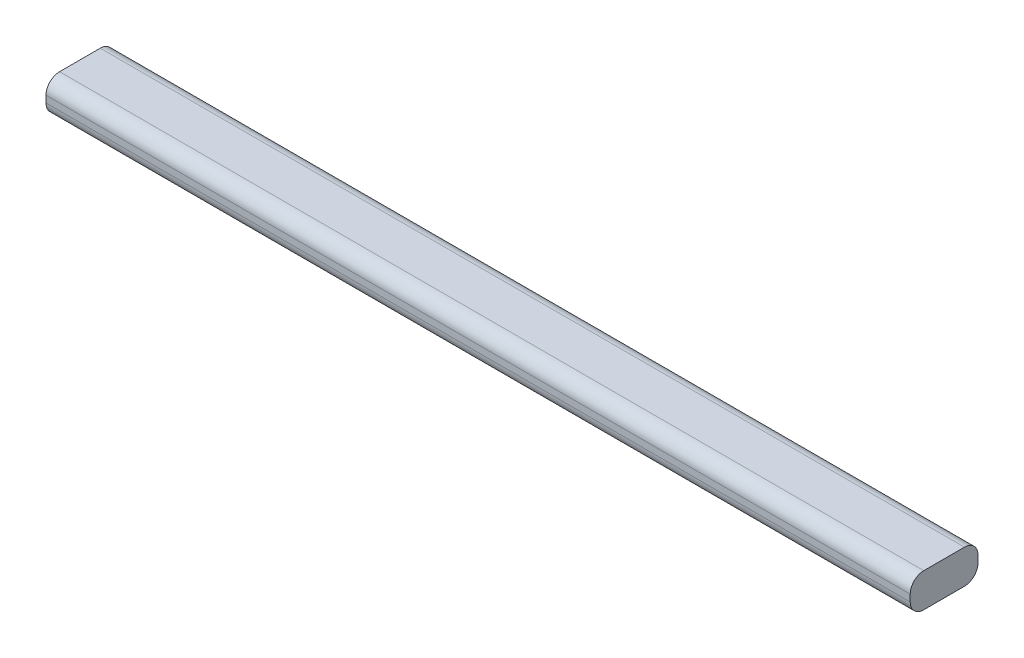
from build123d import *

# Parameters (mm, degrees)
SKETCH1_W           = 127.5
SKETCH1_H           = 10
BOSS_EXTRUDE1_DEPTH = 5
FILLET1_R           = 2
FILLET2_R           = 2
FILLET3_R           = 2
FILLET4_R           = 2


with BuildPart() as part:
    # Sketch1 → Boss-Extrude1 (new body)
    with BuildSketch(Plane(origin=(0, 0, 0), x_dir=(1, 0, 0), z_dir=(0, 1, 0))):
        Rectangle(SKETCH1_W, SKETCH1_H)
    extrude(amount=BOSS_EXTRUDE1_DEPTH)

    # Fillet1
    fillet1_edges = [part.edges().sort_by_distance(p)[0] for p in [
        (0, 5, 5),
    ]]
    fillet(fillet1_edges, radius=FILLET1_R)

    # Fillet2
    fillet2_edges = [part.edges().sort_by_distance(p)[0] for p in [
        (0, 0, 5),
    ]]
    fillet(fillet2_edges, radius=FILLET2_R)

    # Fillet3
    fillet3_edges = [part.edges().sort_by_distance(p)[0] for p in [
        (0, 5, -5),
    ]]
    fillet(fillet3_edges, radius=FILLET3_R)

    # Fillet4
    fillet4_edges = [part.edges().sort_by_distance(p)[0] for p in [
        (0, 0, -5),
    ]]
    fillet(fillet4_edges, radius=FILLET4_R)


solid = part.part
